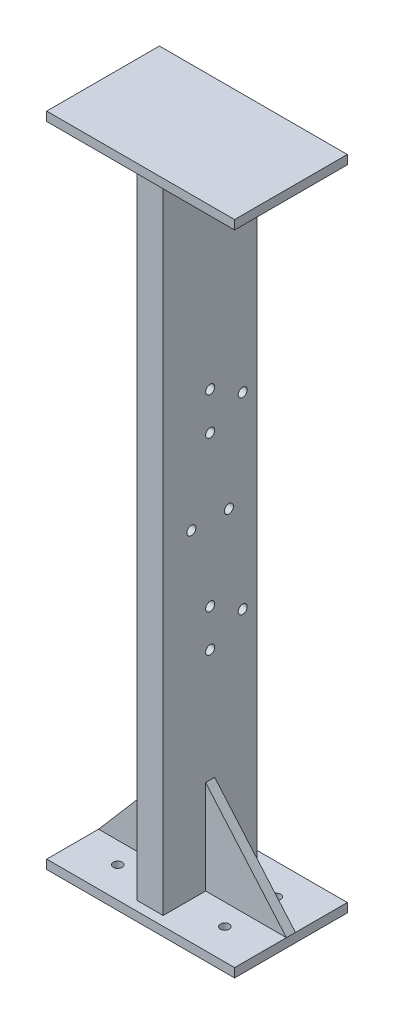
from build123d import *

# Parameters (mm, degrees)
SKETCH2_W           = 35
SKETCH2_H           = 125
SKETCH2_W_2         = 11
SKETCH2_H_2         = 101
BOSS_EXTRUDE1_DEPTH = 850
SKETCH3_R           = 6
CUT_EXTRUDE1_DEPTH  = 860.854638878
SKETCH4_W           = 250
SKETCH4_H           = 150
BOSS_EXTRUDE2_DEPTH = 12
SKETCH5_W           = 250
SKETCH5_H           = 150
BOSS_EXTRUDE3_DEPTH = 12
BOSS_EXTRUDE4_START = -62.5
BOSS_EXTRUDE4_DEPTH = 6
SKETCH8_R           = 6
CUT_EXTRUDE2_DEPTH  = 12


with BuildPart() as part:
    # Sketch2 → Boss-Extrude1 (new body)
    with BuildSketch(Plane(origin=(0, 0, 0), x_dir=(1, 0, 0), z_dir=(0, 1, 0))):
        with Locations((17.5, 62.5)):
            Rectangle(SKETCH2_W, SKETCH2_H)
        with Locations((17.5, 62.5)):
            Rectangle(SKETCH2_W_2, SKETCH2_H_2, mode=Mode.SUBTRACT)
    extrude(amount=BOSS_EXTRUDE1_DEPTH)

    # Sketch3 → Cut-Extrude1 (cut, through all)
    with BuildSketch(Plane(origin=(35, 0, 0), x_dir=(0, 0, -1), z_dir=(1, 0, 0))):
        with Locations((62.5, 575)):
            Circle(SKETCH3_R)
        with Locations((62.5, 525)):
            Circle(SKETCH3_R)
        with Locations((105.801270189, 550)):
            Circle(SKETCH3_R)
        with Locations((37.5, 425)):
            Circle(SKETCH3_R)
        with Locations((87.5, 425)):
            Circle(SKETCH3_R)
        with Locations((105.801270189, 300)):
            Circle(SKETCH3_R)
        with Locations((62.5, 325)):
            Circle(SKETCH3_R)
        with Locations((62.5, 275)):
            Circle(SKETCH3_R)
    extrude(amount=-CUT_EXTRUDE1_DEPTH, mode=Mode.SUBTRACT)

    # Sketch4 → Boss-Extrude2 (add)
    with BuildSketch(Plane(origin=(0, 0, 0), x_dir=(-1, 0, 0), z_dir=(0, -1, 0))):
        with Locations((-17.5, 62.5)):
            Rectangle(SKETCH4_W, SKETCH4_H)
    extrude(amount=BOSS_EXTRUDE2_DEPTH)

    # Sketch5 → Boss-Extrude3 (add)
    with BuildSketch(Plane(origin=(0, 850, 0), x_dir=(1, 0, 0), z_dir=(0, 1, 0))):
        with Locations((17.5, 62.5)):
            Rectangle(SKETCH5_W, SKETCH5_H)
    extrude(amount=BOSS_EXTRUDE3_DEPTH)

    # Sketch7 → Boss-Extrude4 (add, symmetric)
    with BuildSketch(Plane(origin=(0, 0, -125), x_dir=(-1, 0, 0), z_dir=(0, 0, -1)).offset(BOSS_EXTRUDE4_START)):
        Polygon((-35, 0), (-35, 125), (-142.5, 0), align=None)
        Polygon((0, 125), (107.5, 0), (0, 0), align=None)
    extrude(amount=BOSS_EXTRUDE4_DEPTH, both=True)

    # Sketch8 → Cut-Extrude2 (cut)
    with BuildSketch(Plane(origin=(0, 0, 0), x_dir=(1, 0, 0), z_dir=(0, 1, 0))):
        with Locations(Location((-53.75, 28.25, 0), (0, 0, 270))):
            Circle(SKETCH8_R)
        with Locations(Location((-53.75, 96.75, 0), (0, 0, 270))):
            Circle(SKETCH8_R)
        with Locations(Location((88.75, 28.25, 0), (0, 0, 270))):
            Circle(SKETCH8_R)
        with Locations(Location((88.75, 96.75, 0), (0, 0, 270))):
            Circle(SKETCH8_R)
    extrude(amount=-CUT_EXTRUDE2_DEPTH, mode=Mode.SUBTRACT)


solid = part.part
